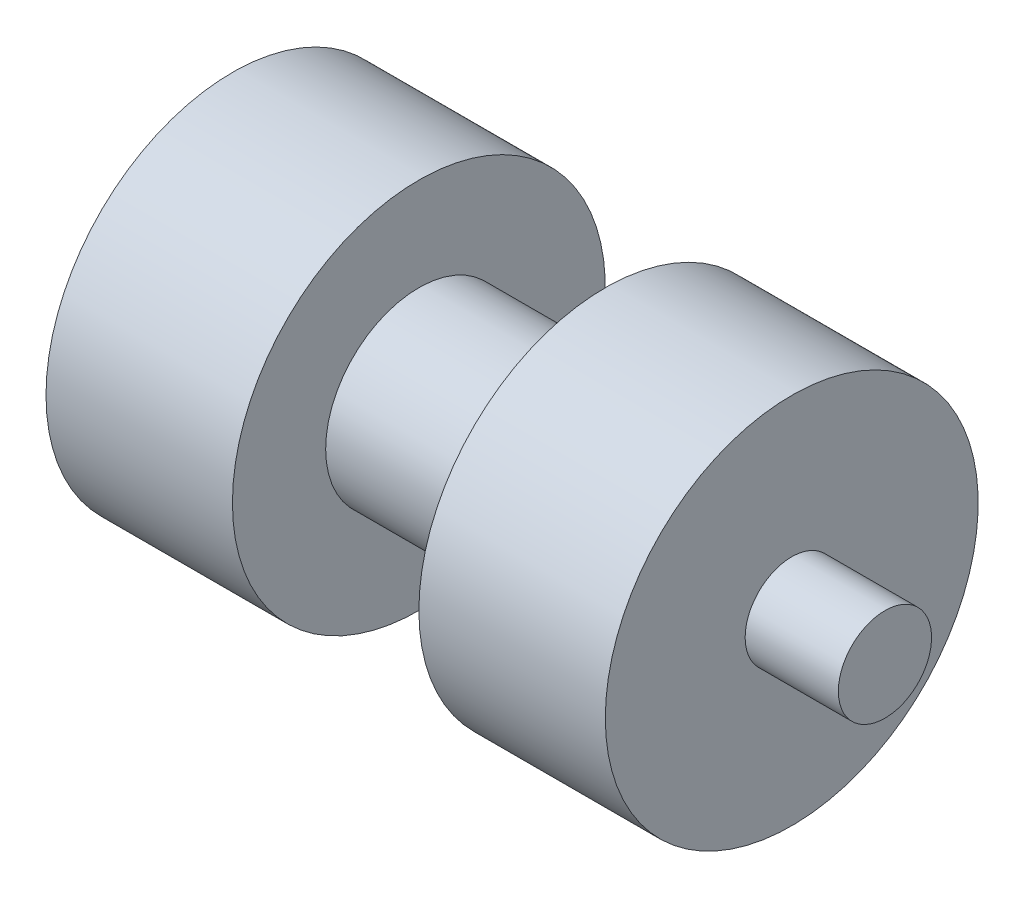
from build123d import *


with BuildPart() as part:
    # Sketch3 → Revolve1 (revolve)
    with BuildSketch(Plane.XY, mode=Mode.PRIVATE) as revolve1_sk:
        Polygon((-20, 0), (20, 0), (20, 2.5), (15, 2.5), (15, 10), (5, 10), (5, 5), (-5, 5), (-5, 10), (-15, 10), (-15, 2.5), (-20, 2.5), align=None)
    revolve(revolve1_sk.sketch.rotate(Axis((-20, 0, 0), (1, 0, 0)), 90), axis=Axis((-20, 0, 0), (1, 0, 0)))


solid = part.part
